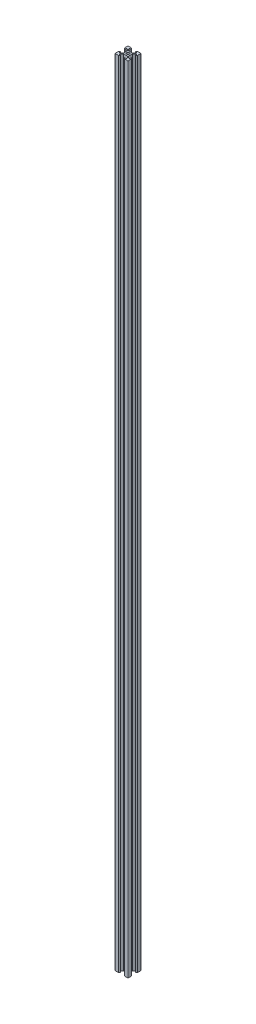
from build123d import *

# Parameters (mm, degrees)
SKETCH2_R              = 2.074585303
VSLOT2020_2020_5_DEPTH = 1220


with BuildPart() as part:
    # Sketch2 → Vslot2020 2020(5) (new body)
    with BuildSketch(Plane.ZX):
        with BuildLine():
            Line((13.9, 7.149086807), (13.9, 12.844511469))
            Line((13.9, 12.844511469), (16.558493656, 15.492177728))
            Line((16.558493656, 15.492177728), (16.550703242, 15.5))
            Line((16.550703242, 15.5), (18.2, 15.5))
            Line((18.2, 15.5), (18.2, 13.12))
            Line((18.2, 13.12), (18.534428266, 13.12))
            Line((18.534428266, 13.12), (20, 14.58))
            Line((20, 14.58), (20, 19.5))
            ThreePointArc((20, 19.5), (19.853553391, 19.853553391), (19.5, 20))
            Line((19.5, 20), (14.575, 20))
            Line((14.575, 20), (13.12, 18.545))
            Line((13.12, 18.545), (13.12, 18.2))
            Line((13.12, 18.2), (15.5, 18.2))
            Line((15.5, 18.2), (15.5, 16.555))
            Line((15.5, 16.555), (12.834142613, 13.9))
            Line((12.834142613, 13.9), (7.155, 13.9))
            Line((7.155, 13.9), (4.5, 16.555))
            Line((4.5, 16.555), (4.5, 18.2))
            Line((4.5, 18.2), (6.875, 18.2))
            Line((6.875, 18.2), (6.875, 18.545))
            Line((6.875, 18.545), (5.42, 20))
            Line((5.42, 20), (0.5, 20))
            ThreePointArc((0.5, 20), (0.146446609, 19.853553391), (0, 19.5))
            Line((0, 19.5), (0, 14.58))
            Line((0, 14.58), (1.46, 13.12))
            Line((1.46, 13.12), (1.8, 13.12))
            Line((1.8, 13.12), (1.8, 15.5))
            Line((1.8, 15.5), (3.445, 15.5))
            Line((3.445, 15.5), (3.439339828, 15.494339828))
            Line((3.439339828, 15.494339828), (6.094339828, 12.839339828))
            Line((6.094339828, 12.839339828), (6.1, 12.845))
            Line((6.1, 12.845), (6.1, 7.149086807))
            Line((6.1, 7.149086807), (3.439339828, 4.5))
            Line((3.439339828, 4.5), (1.8, 4.5))
            Line((1.8, 4.5), (1.8, 6.88))
            Line((1.8, 6.88), (1.46, 6.88))
            Line((1.46, 6.88), (0, 5.42))
            Line((0, 5.42), (0, 0.5))
            ThreePointArc((0, 0.5), (0.146446609, 0.146446609), (0.5, 0))
            Line((0.5, 0), (5.42, 0))
            Line((5.42, 0), (6.875, 1.455))
            Line((6.875, 1.455), (6.875, 1.8))
            Line((6.875, 1.8), (4.5, 1.8))
            Line((4.5, 1.8), (4.5, 3.4393348))
            Line((4.5, 3.4393348), (7.158345795, 6.086117297))
            Line((7.158345795, 6.086117297), (7.144523479, 6.1))
            Line((7.144523479, 6.1), (12.854625295, 6.1))
            Line((12.854625295, 6.1), (12.841221344, 6.086548451))
            Line((12.841221344, 6.086548451), (15.499715, 3.437461644))
            Line((15.499715, 3.437461644), (15.5, 1.8))
            Line((15.5, 1.8), (13.12, 1.8))
            Line((13.12, 1.8), (13.12, 1.455))
            Line((13.12, 1.455), (14.575, 0))
            Line((14.575, 0), (19.5, 0))
            ThreePointArc((19.5, 0), (19.853553391, 0.146446609), (20, 0.5))
            Line((20, 0.5), (20, 5.42))
            Line((20, 5.42), (18.606904708, 6.88))
            Line((18.606904708, 6.88), (18.2, 6.88))
            Line((18.2, 6.88), (18.2, 4.5))
            Line((18.2, 4.5), (16.558493656, 4.5))
            Line((16.558493656, 4.5), (13.9, 7.149086807))
        make_face()
        with Locations((10, 10)):
            Circle(SKETCH2_R, mode=Mode.SUBTRACT)
    extrude(amount=VSLOT2020_2020_5_DEPTH)


solid = part.part
